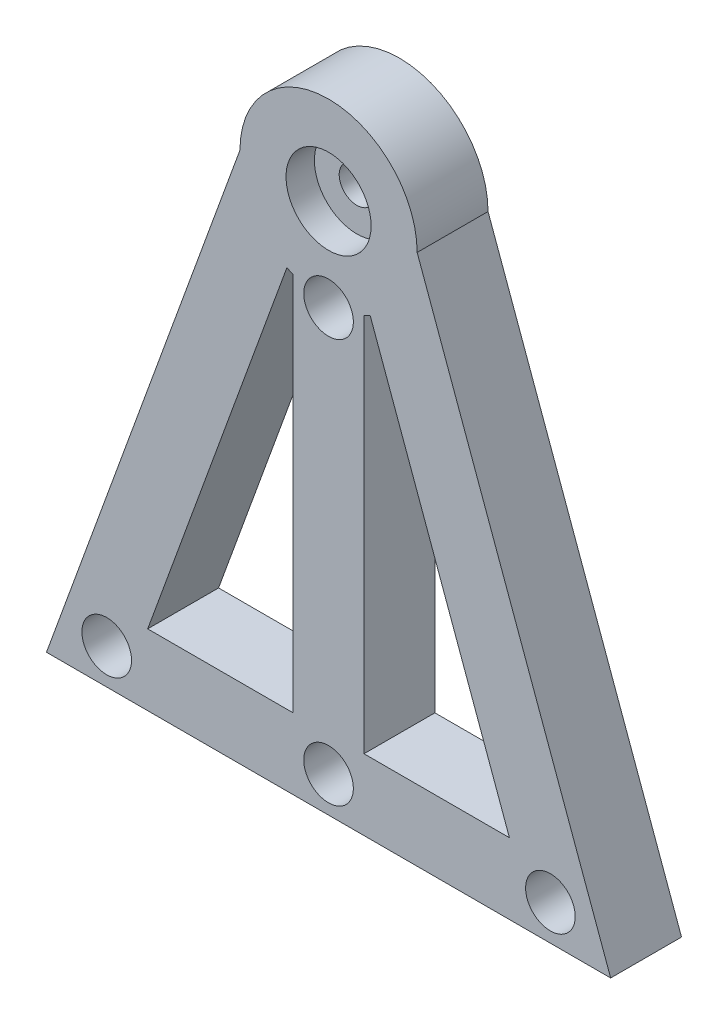
from build123d import *

# Parameters (mm, degrees)
SKETCH1_R           = 12.5
BOSS_EXTRUDE1_DEPTH = 10
CUT_EXTRUDE1_REACH  = 98.644
SKETCH2_R           = 2.5
SKETCH2_3_R         = 6
SKETCH2_3_R_2       = 2.5
CUT_EXTRUDE2_DEPTH  = 4
CUT_EXTRUDE4_REACH  = 98.644
SKETCH3_R           = 1.5
SKETCH3_4_R         = 3.5
SKETCH3_4_R_2       = 1.5
CUT_EXTRUDE5_DEPTH  = 5


with BuildPart() as part:
    # Sketch1 → Boss-Extrude1 (new body)
    with BuildSketch(Plane.XY):
        with Locations((0, 75)):
            Circle(SKETCH1_R)
        with BuildLine():
            Line((-39.79776757, 0), (39.79776757, 0))
            Line((39.79776757, 0), (12.5, 75))
            ThreePointArc((12.5, 75), (10.716279715, 68.564834962), (5.87418415, 63.966235431))
            Line((5.87418415, 63.966235431), (25.516287503, 10))
            Line((25.516287503, 10), (-25.516287503, 10))
            Line((-25.516287503, 10), (-5.87418415, 63.966235431))
            ThreePointArc((-5.87418415, 63.966235431), (-10.716279715, 68.564834962), (-12.5, 75))
            Line((-12.5, 75), (-39.79776757, 0))
        make_face()
        with BuildLine():
            Line((-5, 10), (5, 10))
            Line((5, 10), (5, 63.543560763))
            ThreePointArc((5, 63.543560763), (0, 62.5), (-5, 63.543560763))
            Line((-5, 63.543560763), (-5, 10))
        make_face()
    extrude(amount=BOSS_EXTRUDE1_DEPTH)

    # Sketch2 → Cut-Extrude1 (cut, up to next)
    with BuildSketch(Plane.XY.offset(10), mode=Mode.PRIVATE) as cut_extrude1_sk1:
        with Locations((0, 75)):
            Circle(SKETCH2_R)
    cut_extrude1_tool1 = extrude(cut_extrude1_sk1.sketch, amount=-CUT_EXTRUDE1_REACH, mode=Mode.PRIVATE) & part.part
    add(cut_extrude1_tool1.solids().sort_by_distance((0, 75, 10))[0], mode=Mode.SUBTRACT)

    # Sketch2<3> → Cut-Extrude2 (cut)
    with BuildSketch(Plane.XY.offset(10)):
        with Locations((0, 75)):
            Circle(SKETCH2_3_R)
        with Locations((0, 75)):
            Circle(SKETCH2_3_R_2, mode=Mode.SUBTRACT)
    extrude(amount=-CUT_EXTRUDE2_DEPTH, mode=Mode.SUBTRACT)

    # Sketch3 → Cut-Extrude4 (cut, up to next)
    with BuildSketch(Plane.XY.offset(10), mode=Mode.PRIVATE) as cut_extrude4_sk1:
        with Locations((0, 5)):
            Circle(SKETCH3_R)
    cut_extrude4_tool1 = extrude(cut_extrude4_sk1.sketch, amount=-CUT_EXTRUDE4_REACH, mode=Mode.PRIVATE) & part.part
    # Sketch3 → Cut-Extrude4 (cut, up to next)
    with BuildSketch(Plane.XY.offset(10), mode=Mode.PRIVATE) as cut_extrude4_sk2:
        with Locations((31.29776757, 5)):
            Circle(SKETCH3_R)
    cut_extrude4_tool2 = extrude(cut_extrude4_sk2.sketch, amount=-CUT_EXTRUDE4_REACH, mode=Mode.PRIVATE) & part.part
    # Sketch3 → Cut-Extrude4 (cut, up to next)
    with BuildSketch(Plane.XY.offset(10), mode=Mode.PRIVATE) as cut_extrude4_sk3:
        with Locations((-31.29776757, 5)):
            Circle(SKETCH3_R)
    cut_extrude4_tool3 = extrude(cut_extrude4_sk3.sketch, amount=-CUT_EXTRUDE4_REACH, mode=Mode.PRIVATE) & part.part
    # Sketch3 → Cut-Extrude4 (cut, up to next)
    with BuildSketch(Plane.XY.offset(10), mode=Mode.PRIVATE) as cut_extrude4_sk4:
        with Locations((0, 62)):
            Circle(SKETCH3_R)
    cut_extrude4_tool4 = extrude(cut_extrude4_sk4.sketch, amount=-CUT_EXTRUDE4_REACH, mode=Mode.PRIVATE) & part.part
    add(cut_extrude4_tool1.solids().sort_by_distance((0, 5, 10))[0], mode=Mode.SUBTRACT)
    add(cut_extrude4_tool2.solids().sort_by_distance((31.297768, 5, 10))[0], mode=Mode.SUBTRACT)
    add(cut_extrude4_tool3.solids().sort_by_distance((-31.297768, 5, 10))[0], mode=Mode.SUBTRACT)
    add(cut_extrude4_tool4.solids().sort_by_distance((0, 62, 10))[0], mode=Mode.SUBTRACT)

    # Sketch3<4> → Cut-Extrude5 (cut)
    # profile 1 of 4: a face of its own
    with BuildSketch(Plane.XY.offset(10)):
        with Locations((0, 62)):
            Circle(SKETCH3_4_R)
    # profile 2 of 4: a face of its own
    with BuildSketch(Plane.XY.offset(10)):
        with Locations((-31.29776757, 5)):
            Circle(SKETCH3_4_R)
        with Locations((-31.29776757, 5)):
            Circle(SKETCH3_4_R_2, mode=Mode.SUBTRACT)
    # profile 3 of 4: a face of its own
    with BuildSketch(Plane.XY.offset(10)):
        with Locations((0, 5)):
            Circle(SKETCH3_4_R)
        with Locations((0, 5)):
            Circle(SKETCH3_4_R_2, mode=Mode.SUBTRACT)
    # profile 4 of 4: a face of its own
    with BuildSketch(Plane.XY.offset(10)):
        with Locations((31.29776757, 5)):
            Circle(SKETCH3_4_R)
        with Locations((31.29776757, 5)):
            Circle(SKETCH3_4_R_2, mode=Mode.SUBTRACT)
    extrude(amount=-CUT_EXTRUDE5_DEPTH, mode=Mode.SUBTRACT)


solid = part.part
